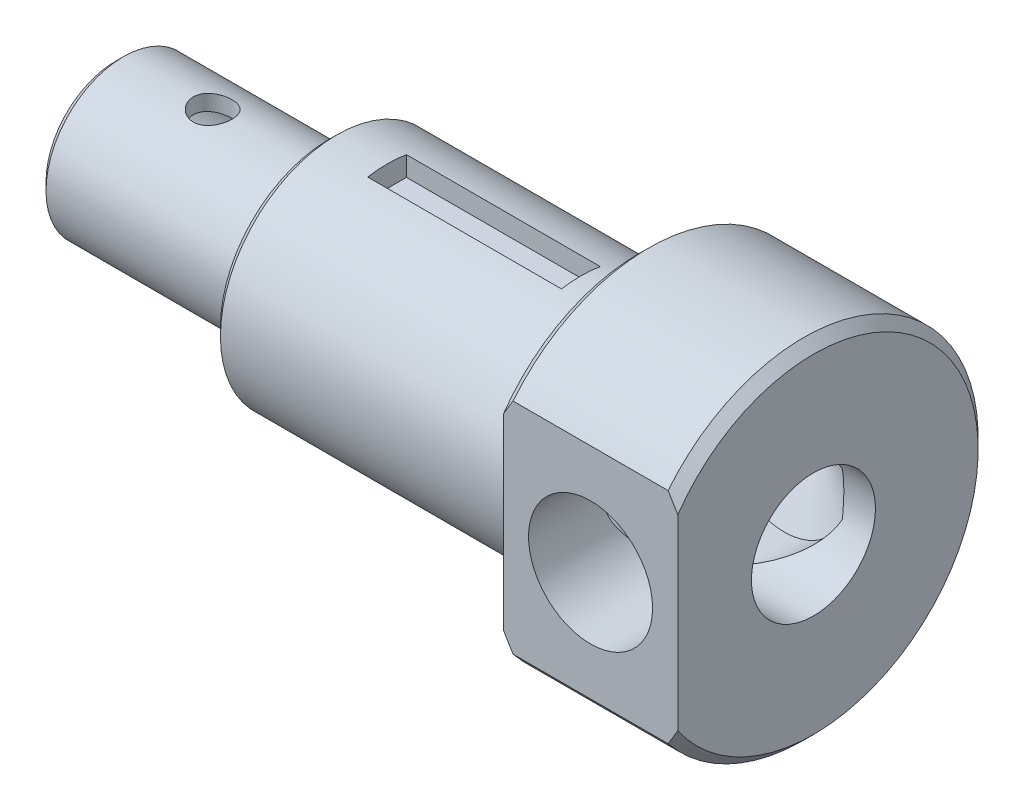
from build123d import *

# Parameters (mm, degrees)
CUT_EXTRUDE_9_DEPTH         = 191.91883092
CUT_EXTRUDE_9_DEPTH_BACK    = 191.91883092
SKETCH_6_W                  = 50
SKETCH_6_H                  = 5.5
CUT_EXTRUDE_4_DEPTH         = 5
CUT_EXTRUDE_10_DEPTH        = 191.91883092
CUT_EXTRUDE_10_DEPTH_BACK   = 191.91883092
SKETCH_16_R                 = 5
HOLE_WIZARD_0_15_32_1_D     = 32
HOLE_WIZARD_0_15_32_1_DEPTH = 50
HOLE_WIZARD_0_15_32_1_TIP   = 9.613769904
CHAMFER_3_SIZE              = 2
CHAMFER_4_SIZE              = 2.5


with BuildPart() as part:
    # Эскиз1 → Повернуть1 (revolve)
    with BuildSketch(Plane.XY, mode=Mode.PRIVATE) as revolve_1_sk:
        Polygon((0, 16), (0, 20), (55, 20), (55, 30), (135, 30), (135, 45), (180, 45), (180, 16), align=None)
    revolve(revolve_1_sk.sketch.rotate(Axis((0, 0, 0), (-1, 0, 0)), 90), axis=Axis((0, 0, 0), (-1, 0, 0)))

    # Эскиз15 → Вырез-Вытянуть9 (cut, two sides: drawn at the far end of the back side and taken through both)
    with BuildSketch(Plane(origin=(180, 0, 0), x_dir=(0, 0, -1), z_dir=(1, 0, 0)).offset(-CUT_EXTRUDE_9_DEPTH_BACK)):
        with BuildLine():
            Line((-35, -28.284271247), (-35, 28.284271247))
            ThreePointArc((-35, 28.284271247), (-45, 0), (-35, -28.284271247))
        make_face()
    extrude(amount=CUT_EXTRUDE_9_DEPTH + CUT_EXTRUDE_9_DEPTH_BACK, mode=Mode.SUBTRACT)

    # Эскиз6 → Вырез-Вытянуть4 (cut, symmetric)
    with BuildSketch(Plane.XY):
        with Locations((95, 27.25)):
            Rectangle(SKETCH_6_W, SKETCH_6_H)
    extrude(amount=CUT_EXTRUDE_4_DEPTH, both=True, mode=Mode.SUBTRACT)

    # Эскиз16 → Вырез-Вытянуть10 (cut, two sides: drawn at the far end of the back side and taken through both)
    with BuildSketch(Plane(origin=(0, 0, 0), x_dir=(1, 0, 0), z_dir=(0, 1, 0)).offset(-CUT_EXTRUDE_10_DEPTH_BACK)):
        with Locations(Location((25, 0, 0), (0, 0, 270))):
            Circle(SKETCH_16_R)
    extrude(amount=CUT_EXTRUDE_10_DEPTH + CUT_EXTRUDE_10_DEPTH_BACK, mode=Mode.SUBTRACT)

    # Диаметр отверстия Ø0.15 (32)1
    with Locations(Plane.XY.offset(35)):
        with Locations((157.5, 0)):
            Hole(HOLE_WIZARD_0_15_32_1_D / 2, depth=HOLE_WIZARD_0_15_32_1_DEPTH)
            with Locations((0, 0, -(HOLE_WIZARD_0_15_32_1_DEPTH + HOLE_WIZARD_0_15_32_1_TIP / 2))):  # 118° drill point
                Cone(0, HOLE_WIZARD_0_15_32_1_D / 2, HOLE_WIZARD_0_15_32_1_TIP, mode=Mode.SUBTRACT)

    # Фаска3
    chamfer_3_edges = [part.edges().sort_by_distance(p)[0] for p in [
        (55, 0, 30),
        (0, 0, 20),
    ]]
    chamfer(chamfer_3_edges, length=CHAMFER_3_SIZE)

    # Фаска4
    chamfer_4_edges = [part.edges().sort_by_distance(p)[0] for p in [
        (180, 0, -45),
        (135, 0, -45),
    ]]
    chamfer(chamfer_4_edges, length=CHAMFER_4_SIZE)


solid = part.part
